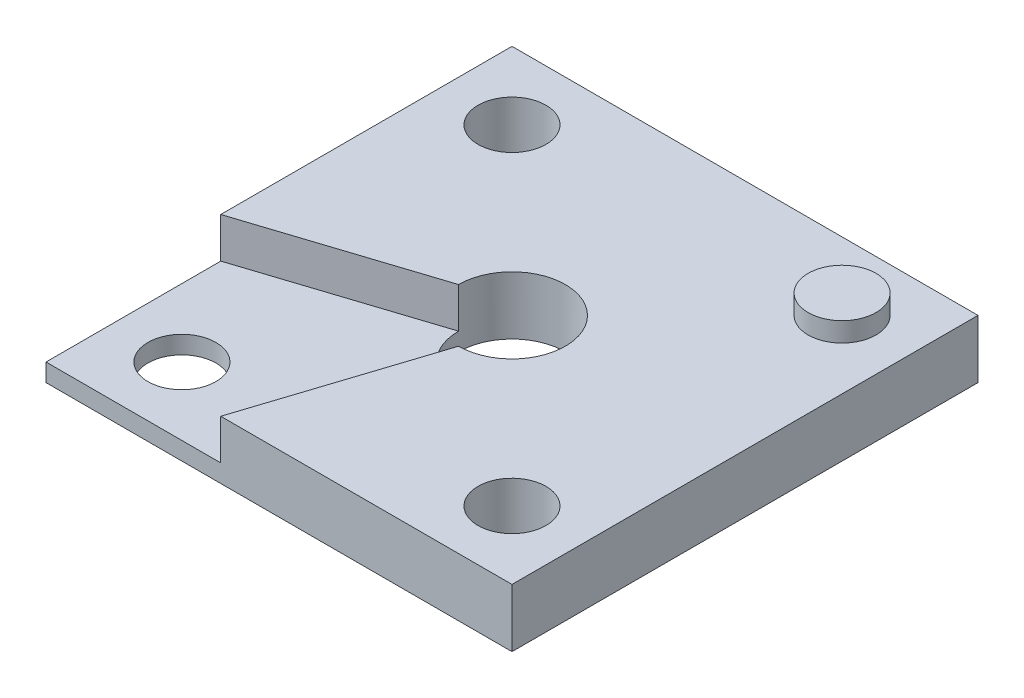
from build123d import *

# Parameters (mm, degrees)
SKETCH1_W           = 76.2
SKETCH1_H           = 76.2
SKETCH1_R           = 5.55625
SKETCH1_R_2         = 8.73125
BOSS_EXTRUDE1_DEPTH = 9.525
CUT_EXTRUDE1_DEPTH  = 6.604
SKETCH1_3_R         = 5.55625
BOSS_EXTRUDE2_DEPTH = 12.7


with BuildPart() as part:
    # Sketch1 → Boss-Extrude1 (new body)
    with BuildSketch(Plane(origin=(0, 0, 0), x_dir=(1, 0, 0), z_dir=(0, 1, 0))):
        Rectangle(SKETCH1_W, SKETCH1_H)
        with Locations((-26.9875, -26.9875)):
            Circle(SKETCH1_R, mode=Mode.SUBTRACT)
        with Locations((26.9875, -26.9875)):
            Circle(SKETCH1_R, mode=Mode.SUBTRACT)
        Circle(SKETCH1_R_2, mode=Mode.SUBTRACT)
        with Locations((-26.9875, 26.9875)):
            Circle(SKETCH1_R, mode=Mode.SUBTRACT)
    extrude(amount=BOSS_EXTRUDE1_DEPTH)

    # Sketch2 → Cut-Extrude1 (cut)
    with BuildSketch(Plane(origin=(0, 9.525, 0), x_dir=(1, 0, 0), z_dir=(0, 1, 0))):
        Polygon((-38.1, -9.525), (-8.73125, 0), (0, -8.73125), (-9.525, -38.1), (-38.1, -38.1), align=None)
    extrude(amount=-CUT_EXTRUDE1_DEPTH, mode=Mode.SUBTRACT)

    # Sketch1<3> → Boss-Extrude2 (add)
    with BuildSketch(Plane(origin=(0, 0, 0), x_dir=(1, 0, 0), z_dir=(0, 1, 0))):
        with Locations((26.9875, 26.9875)):
            Circle(SKETCH1_3_R)
    extrude(amount=BOSS_EXTRUDE2_DEPTH)


solid = part.part
